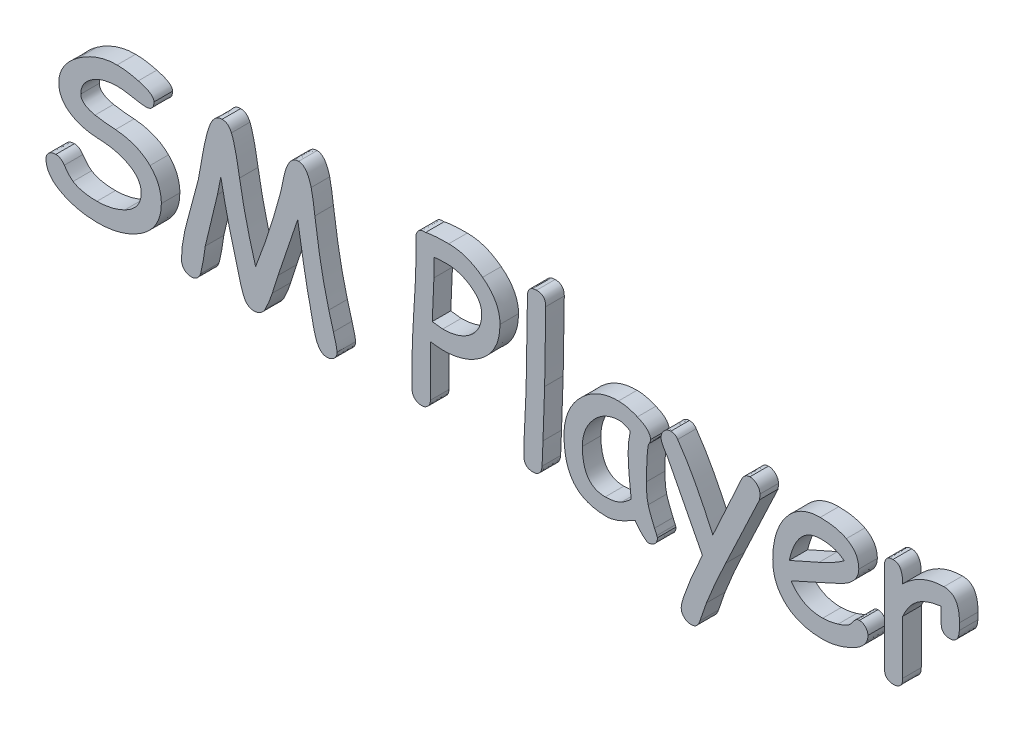
from build123d import *

# Parameters (mm, degrees)
BOSS_EXTRUDE1_DEPTH   = 1
BOSS_EXTRUDE1_2_DEPTH = 1
BOSS_EXTRUDE1_3_DEPTH = 1
BOSS_EXTRUDE1_4_DEPTH = 1
BOSS_EXTRUDE1_5_DEPTH = 1
BOSS_EXTRUDE1_6_DEPTH = 1
BOSS_EXTRUDE1_7_DEPTH = 1
BOSS_EXTRUDE1_8_DEPTH = 1


with BuildPart() as part:
    # Sketch1 → Boss-Extrude1 (new body)
    with BuildSketch(Plane.XY):
        with BuildLine():
            add(Edge.make_bspline(
                [(-23.681181073, 12.970587133), (-23.680205537, 13.005260343), (-23.678320451, 13.072261475), (-23.64907541, 13.167877608), (-23.600023652, 13.253308276), (-23.531739083, 13.326499313), (-23.449779316, 13.387193341), (-23.356809008, 13.430347792), (-23.254576781, 13.455812214), (-23.18396127, 13.459404232), (-23.147294087, 13.461269391)],
                knots=[0, 0, 0, 0, 1.020978776, 1.972898741, 2.919100688, 3.908607674, 4.908561358, 5.914730999, 6.917221763, 8, 8, 8, 8], degree=3))
            add(Edge.make_bspline(
                [(-23.147294087, 13.461269391), (-23.104984149, 13.458270384), (-23.019366104, 13.452201617), (-22.898968179, 13.392152026), (-22.786376137, 13.302018344), (-22.725866295, 13.221677569), (-22.693644452, 13.178895639)],
                knots=[0, 0, 0, 0, 0.907817167, 1.837051385, 2.848217297, 4, 4, 4, 4], degree=3))
            add(Edge.make_bspline(
                [(-22.693644452, 13.178895639), (-22.651124056, 13.119733054), (-22.571503048, 13.008948935), (-22.450418068, 12.862181594), (-22.33660403, 12.744458129), (-22.256674928, 12.6847827), (-22.219935479, 12.657352861)],
                knots=[0, 0, 0, 0, 1.23447497, 2.31159988, 3.223926103, 4, 4, 4, 4], degree=3))
            add(Edge.make_bspline(
                [(-22.219935479, 12.657352861), (-22.181299581, 12.634357784), (-22.102051527, 12.587191412), (-21.970856973, 12.531489934), (-21.829092636, 12.481074885), (-21.673652808, 12.443813624), (-21.506275422, 12.412923908), (-21.326586702, 12.389467511), (-21.133798093, 12.377955582), (-21.001471763, 12.375993574), (-20.93305182, 12.374979108)],
                knots=[0, 0, 0, 0, 0.807895578, 1.657115672, 2.558318706, 3.511992341, 4.528196508, 5.619539607, 6.769171901, 8, 8, 8, 8], degree=3))
            add(Edge.make_bspline(
                [(-20.93305182, 12.374979108), (-20.866167701, 12.376437837), (-20.733771705, 12.379325366), (-20.536775894, 12.394118241), (-20.343901972, 12.423069273), (-20.153397493, 12.459057157), (-19.96694014, 12.508696594), (-19.784597599, 12.569837479), (-19.604663969, 12.637715338), (-19.48940635, 12.693982459), (-19.43168755, 12.722159951)],
                knots=[0, 0, 0, 0, 1.032504842, 2.043826106, 3.046385216, 4.04124581, 5.034838662, 6.021429811, 7.009170089, 8, 8, 8, 8], degree=3))
            add(Edge.make_bspline(
                [(-19.43168755, 12.722159951), (-19.361389446, 12.759788967), (-19.226631456, 12.831921927), (-19.044945366, 12.959914133), (-18.891687407, 13.098892406), (-18.763347063, 13.24771901), (-18.667617247, 13.410535862), (-18.596372141, 13.582586149), (-18.553764501, 13.766275614), (-18.548604895, 13.892583476), (-18.545990643, 13.956580728)],
                knots=[0, 0, 0, 0, 1.189786699, 2.280762261, 3.308288894, 4.272931975, 5.202800241, 6.115543574, 7.045189811, 8, 8, 8, 8], degree=3))
            add(Edge.make_bspline(
                [(-18.545990643, 13.956580728), (-18.548524432, 14.009733076), (-18.553497665, 14.114058698), (-18.588153027, 14.26657888), (-18.647513231, 14.409766391), (-18.73103721, 14.544082488), (-18.836981253, 14.669858973), (-18.966730642, 14.785873857), (-19.119367978, 14.892960373), (-19.232459506, 14.954023485), (-19.291272187, 14.98577905)],
                knots=[0, 0, 0, 0, 0.949240243, 1.863136486, 2.777725302, 3.705920659, 4.677662452, 5.705515345, 6.80676479, 8, 8, 8, 8], degree=3))
            add(Edge.make_bspline(
                [(-19.291272187, 14.98577905), (-19.344871905, 15.012414134), (-19.453334528, 15.06631201), (-19.626091837, 15.13121212), (-19.806525912, 15.190430539), (-19.996579458, 15.239898559), (-20.196656843, 15.27824904), (-20.405891411, 15.306468831), (-20.623994258, 15.329575566), (-20.772516957, 15.334884307), (-20.848185391, 15.337588971)],
                knots=[0, 0, 0, 0, 0.891996852, 1.805015421, 2.748548653, 3.723361584, 4.731199176, 5.784448007, 6.871234155, 8, 8, 8, 8], degree=3))
            add(Edge.make_bspline(
                [(-20.848185391, 15.337588971), (-20.91561633, 15.340999472), (-21.048182288, 15.347704352), (-21.242867596, 15.369642965), (-21.429864535, 15.40032426), (-21.609276389, 15.440148361), (-21.780934855, 15.490405721), (-21.946221361, 15.54610004), (-22.102823619, 15.614367344), (-22.201762937, 15.667631123), (-22.250795999, 15.694027971)],
                knots=[0, 0, 0, 0, 1.109083175, 2.180403794, 3.216792943, 4.22137708, 5.197588291, 6.154329841, 7.085309469, 8, 8, 8, 8], degree=3))
            add(Edge.make_bspline(
                [(-22.250795999, 15.694027971), (-22.309307595, 15.729207612), (-22.423360598, 15.797781091), (-22.574781792, 15.920151388), (-22.703852378, 16.053883261), (-22.806991412, 16.20041482), (-22.891578696, 16.355915771), (-22.94718367, 16.52485498), (-22.985094918, 16.70404865), (-22.988275822, 16.827943357), (-22.989905438, 16.891416124)],
                knots=[0, 0, 0, 0, 1.104423339, 2.152783505, 3.142433753, 4.103820206, 5.046408413, 5.997202751, 6.973942584, 8, 8, 8, 8], degree=3))
            add(Edge.make_bspline(
                [(-22.989905438, 16.891416124), (-22.986491654, 16.96727993), (-22.979639118, 17.119562359), (-22.928472261, 17.34423321), (-22.845071472, 17.563644601), (-22.728536177, 17.777705168), (-22.575730532, 17.984469353), (-22.395388183, 18.189483647), (-22.178033651, 18.38604138), (-22.016764355, 18.507231042), (-21.932932649, 18.57022838)],
                knots=[0, 0, 0, 0, 0.882315765, 1.771084206, 2.667078851, 3.607169967, 4.597299244, 5.653059042, 6.780002939, 8, 8, 8, 8], degree=3))
            add(Edge.make_bspline(
                [(-21.932932649, 18.57022838), (-21.849418924, 18.627613784), (-21.685000508, 18.74059183), (-21.427645067, 18.884815517), (-21.169630629, 19.009033476), (-20.909579576, 19.11191242), (-20.646815502, 19.190931013), (-20.381912219, 19.245985275), (-20.115212255, 19.281999771), (-19.936371951, 19.285820851), (-19.846761537, 19.287735456)],
                knots=[0, 0, 0, 0, 1.084105602, 2.134342923, 3.153783451, 4.147494286, 5.124611481, 6.086661538, 7.041295226, 8, 8, 8, 8], degree=3))
            add(Edge.make_bspline(
                [(-19.846761537, 19.287735456), (-19.759248209, 19.28537373), (-19.57858242, 19.280498093), (-19.299533087, 19.248334646), (-19.005010308, 19.193831695), (-18.804968985, 19.143797884), (-18.701836266, 19.118002599)],
                knots=[0, 0, 0, 0, 0.904920533, 1.868151822, 2.900910592, 4, 4, 4, 4], degree=3))
            add(Edge.make_bspline(
                [(-18.701836266, 19.118002599), (-18.635239235, 19.099785081), (-18.510257721, 19.065596576), (-18.337415769, 19.005173193), (-18.190378552, 18.941956314), (-18.070145556, 18.872508015), (-17.975596095, 18.800213197), (-17.905843605, 18.72426941), (-17.863952335, 18.640839718), (-17.857739739, 18.582972138), (-17.854715009, 18.55479812)],
                knots=[0, 0, 0, 0, 1.536451653, 2.883432639, 4.072626447, 5.093694848, 5.966289869, 6.712663879, 7.373234022, 8, 8, 8, 8], degree=3))
            add(Edge.make_bspline(
                [(-17.854715009, 18.55479812), (-17.856050374, 18.519160805), (-17.858556209, 18.452286768), (-17.880831223, 18.358825928), (-17.915278836, 18.278120117), (-17.96836828, 18.212347233), (-18.036711887, 18.162415701), (-18.118744667, 18.126394246), (-18.215440945, 18.10723651), (-18.284110204, 18.104271677), (-18.320708852, 18.10269151)],
                knots=[0, 0, 0, 0, 1.147274365, 2.152880138, 3.080677453, 3.953489691, 4.842381196, 5.785320622, 6.819642577, 8, 8, 8, 8], degree=3))
            add(Edge.make_bspline(
                [(-18.320708852, 18.10269151), (-18.361910691, 18.104100458), (-18.457534855, 18.107370443), (-18.619815714, 18.130918604), (-18.821376038, 18.16003699), (-19.048916809, 18.205088641), (-19.281221955, 18.249484096), (-19.496417393, 18.280094835), (-19.682835221, 18.299449505), (-19.797347392, 18.299963283), (-19.849847588, 18.300198835)],
                knots=[0, 0, 0, 0, 0.64035602, 1.486183851, 2.545593541, 3.806237026, 5.090462414, 6.221050272, 7.184407993, 8, 8, 8, 8], degree=3))
            add(Edge.make_bspline(
                [(-19.849847588, 18.300198835), (-19.916248459, 18.297923304), (-20.046757025, 18.293450829), (-20.237938561, 18.27304701), (-20.421609454, 18.24252205), (-20.597555834, 18.199393082), (-20.766405366, 18.143959207), (-20.926954612, 18.075474946), (-21.080658981, 17.997352858), (-21.176807056, 17.935822874), (-21.224683728, 17.905184186)],
                knots=[0, 0, 0, 0, 1.098563762, 2.159188293, 3.177307101, 4.17590561, 5.152410848, 6.113039325, 7.060393052, 8, 8, 8, 8], degree=3))
            add(Edge.make_bspline(
                [(-21.224683728, 17.905184186), (-21.270692258, 17.872709589), (-21.359869382, 17.809764929), (-21.477861497, 17.702038021), (-21.578104542, 17.589784386), (-21.662357345, 17.472796224), (-21.725265355, 17.349127587), (-21.770629458, 17.220472711), (-21.799821288, 17.0866288), (-21.803166793, 16.994949278), (-21.804861493, 16.948508085)],
                knots=[0, 0, 0, 0, 1.156832391, 2.242257832, 3.2758141, 4.246901468, 5.197449485, 6.117149032, 7.046222712, 8, 8, 8, 8], degree=3))
            add(Edge.make_bspline(
                [(-21.804861493, 16.948508085), (-21.802379397, 16.914267884), (-21.797428436, 16.845970015), (-21.760414099, 16.74783432), (-21.697536222, 16.659261971), (-21.610383938, 16.580462558), (-21.50061435, 16.509705513), (-21.368017248, 16.446293601), (-21.210592517, 16.393340333), (-21.096840267, 16.364910869), (-21.03643456, 16.349814008)],
                knots=[0, 0, 0, 0, 0.779947725, 1.555737587, 2.356322645, 3.236265005, 4.218915667, 5.326038242, 6.580049603, 8, 8, 8, 8], degree=3))
            add(Edge.make_bspline(
                [(-21.03643456, 16.349814008), (-21.009742969, 16.343872258), (-20.951513411, 16.330909919), (-20.854512223, 16.316265799), (-20.741329565, 16.301007313), (-20.61117615, 16.285619845), (-20.464571389, 16.270258956), (-20.301492189, 16.255123312), (-20.121552729, 16.239069241), (-19.995940926, 16.230739213), (-19.930084939, 16.22637193)],
                knots=[0, 0, 0, 0, 0.588960752, 1.284858742, 2.112302552, 3.049675239, 4.108181828, 5.287978176, 6.578136203, 8, 8, 8, 8], degree=3))
            add(Edge.make_bspline(
                [(-19.930084939, 16.22637193), (-19.833711914, 16.217576118), (-19.645166388, 16.200367868), (-19.371964573, 16.150039295), (-19.114213211, 16.084304819), (-18.872732322, 15.999803624), (-18.647960749, 15.895547423), (-18.438476548, 15.775460433), (-18.245508543, 15.636203247), (-18.129908789, 15.529602415), (-18.072281671, 15.476461309)],
                knots=[0, 0, 0, 0, 1.134643475, 2.219832288, 3.254399288, 4.252361306, 5.2160512, 6.156708817, 7.081109121, 8, 8, 8, 8], degree=3))
            add(Edge.make_bspline(
                [(-18.072281671, 15.476461309), (-18.023383243, 15.425968633), (-17.926716435, 15.326150171), (-17.801939173, 15.161839765), (-17.695979809, 14.989191025), (-17.609104095, 14.808372782), (-17.54272174, 14.618774884), (-17.494887811, 14.421380343), (-17.464433141, 14.215728591), (-17.461292477, 14.075501005), (-17.45970036, 14.004414533)],
                knots=[0, 0, 0, 0, 1.028307477, 2.03285068, 3.013053631, 3.989779647, 4.963831607, 5.94821947, 6.959877708, 8, 8, 8, 8], degree=3))
            add(Edge.make_bspline(
                [(-17.45970036, 14.004414533), (-17.463247407, 13.903866947), (-17.470230671, 13.705913496), (-17.525715924, 13.417393498), (-17.615196247, 13.143904582), (-17.743556988, 12.887337873), (-17.907222871, 12.64628989), (-18.107076919, 12.421144332), (-18.342905443, 12.211413525), (-18.520861137, 12.090139962), (-18.61234076, 12.027798265)],
                knots=[0, 0, 0, 0, 1.006906322, 1.982350743, 2.932524148, 3.882138281, 4.847028019, 5.843859457, 6.891617794, 8, 8, 8, 8], degree=3))
            add(Edge.make_bspline(
                [(-18.61234076, 12.027798265), (-18.696493711, 11.97664462), (-18.865000373, 11.874215296), (-19.131067238, 11.743136416), (-19.407951369, 11.633655531), (-19.694444759, 11.544617793), (-19.989942304, 11.472183185), (-20.296142006, 11.424714251), (-20.611890687, 11.391628666), (-20.825979283, 11.388851469), (-20.934594846, 11.387442487)],
                knots=[0, 0, 0, 0, 0.96740237, 1.93711262, 2.910412234, 3.890342931, 4.88332579, 5.897071892, 6.933101885, 8, 8, 8, 8], degree=3))
            add(Edge.make_bspline(
                [(-20.934594846, 11.387442487), (-21.013837655, 11.38868693), (-21.170446189, 11.391146338), (-21.403149475, 11.409000059), (-21.63051349, 11.43555821), (-21.85277534, 11.476796456), (-22.069730586, 11.527154139), (-22.282136085, 11.588971378), (-22.489195188, 11.662922021), (-22.623478277, 11.721027452), (-22.6905584, 11.75005359)],
                knots=[0, 0, 0, 0, 1.052595361, 2.080257086, 3.098952793, 4.092052013, 5.081501202, 6.056668516, 7.029223139, 8, 8, 8, 8], degree=3))
            add(Edge.make_bspline(
                [(-22.6905584, 11.75005359), (-22.767525229, 11.787075264), (-22.915399411, 11.858203955), (-23.115412626, 11.985751644), (-23.287499674, 12.121860075), (-23.426031314, 12.27251215), (-23.538676638, 12.430442137), (-23.617723517, 12.601608132), (-23.669615999, 12.782455626), (-23.677302256, 12.907489591), (-23.681181073, 12.970587133)],
                knots=[0, 0, 0, 0, 1.230486047, 2.364097874, 3.413457518, 4.384300228, 5.305970186, 6.198444544, 7.090857273, 8, 8, 8, 8], degree=3))
        make_face()
    extrude(amount=BOSS_EXTRUDE1_DEPTH)


with BuildPart() as body_2:
    # Sketch1 → Boss-Extrude1 2 (new body)
    with BuildSketch(Plane.XY):
        with BuildLine():
            add(Edge.make_bspline(
                [(-8.522493939, 11.288688825), (-8.567342492, 11.291592378), (-8.655731812, 11.297314815), (-8.779862127, 11.355109249), (-8.890512094, 11.445485995), (-8.94761508, 11.52572247), (-8.977686601, 11.567976526)],
                knots=[0, 0, 0, 0, 0.959160072, 1.890351017, 2.889018652, 4, 4, 4, 4], degree=3))
            add(Edge.make_bspline(
                [(-8.977686601, 11.567976526), (-9.00352067, 11.61372269), (-9.061195973, 11.715852321), (-9.128209654, 11.898114654), (-9.197029892, 12.117663235), (-9.234005307, 12.278977023), (-9.253888249, 12.365720952)],
                knots=[0, 0, 0, 0, 0.742751013, 1.658213032, 2.74074123, 4, 4, 4, 4], degree=3))
            Line((-9.253888249, 12.365720952), (-9.43750834, 13.260676015))
            add(Edge.make_bspline(
                [(-9.43750834, 13.260676015), (-9.447038506, 13.298159995), (-9.467209952, 13.377498185), (-9.493620315, 13.505722269), (-9.527615264, 13.648025341), (-9.558590244, 13.8080009), (-9.59502818, 13.982484438), (-9.629720671, 14.173664222), (-9.668207644, 14.379927237), (-9.710800061, 14.601768495), (-9.751258776, 14.839797408), (-9.796700374, 15.092639723), (-9.843026371, 15.361639617), (-9.890214763, 15.646780618), (-9.941690259, 15.947491007), (-9.993947386, 16.263847525), (-10.048025025, 16.595587688), (-10.084105995, 16.821968711), (-10.102552533, 16.937706903)],
                knots=[0, 0, 0, 0, 0.496658207, 1.051221438, 1.68101768, 2.375400972, 3.143623008, 3.970205625, 4.870641242, 5.838436678, 6.871229342, 7.971369117, 9.137717576, 10.376808206, 11.683232474, 13.055897193, 14.494815811, 16, 16, 16, 16], degree=3))
            Line((-10.102552533, 16.937706903), (-11.161068349, 13.797649053))
            Line((-11.161068349, 13.797649053), (-11.474302621, 12.808569406))
            add(Edge.make_bspline(
                [(-11.474302621, 12.808569406), (-11.505250357, 12.714618884), (-11.564534234, 12.534646069), (-11.664749312, 12.28107779), (-11.762768272, 12.052354071), (-11.836089671, 11.912190063), (-11.870860295, 11.8457212)],
                knots=[0, 0, 0, 0, 1.138108356, 2.180174859, 3.13699879, 4, 4, 4, 4], degree=3))
            add(Edge.make_bspline(
                [(-11.870860295, 11.8457212), (-11.889103069, 11.816847998), (-11.924510521, 11.760807917), (-11.989048951, 11.688806317), (-12.055610971, 11.625352472), (-12.128284024, 11.574170689), (-12.206541344, 11.535298911), (-12.289058429, 11.507400251), (-12.376246716, 11.489902452), (-12.436040218, 11.487446135), (-12.46646832, 11.486196149)],
                knots=[0, 0, 0, 0, 1.12138879, 2.176506675, 3.170017907, 4.141537379, 5.087232601, 6.03413754, 6.999599269, 8, 8, 8, 8], degree=3))
            add(Edge.make_bspline(
                [(-12.46646832, 11.486196149), (-12.515928186, 11.489521207), (-12.613068161, 11.496051673), (-12.749001752, 11.555526181), (-12.867670773, 11.651439411), (-12.925360817, 11.737392277), (-12.955607552, 11.782457135)],
                knots=[0, 0, 0, 0, 0.986319395, 1.937147192, 2.918451782, 4, 4, 4, 4], degree=3))
            add(Edge.make_bspline(
                [(-12.955607552, 11.782457135), (-12.975318315, 11.821244047), (-13.016376736, 11.902038958), (-13.067037365, 12.035339797), (-13.121123354, 12.180967846), (-13.150284102, 12.285231616), (-13.165459084, 12.339489511)],
                knots=[0, 0, 0, 0, 0.874902059, 1.822461019, 2.866828981, 4, 4, 4, 4], degree=3))
            Line((-13.165459084, 12.339489511), (-13.31667563, 12.91812425))
            add(Edge.make_bspline(
                [(-13.31667563, 12.91812425), (-13.403460405, 13.229439987), (-13.579520651, 13.861006129), (-13.821079887, 14.829224169), (-14.046505047, 15.829990378), (-14.181721929, 16.509982345), (-14.250206342, 16.8543835)],
                knots=[0, 0, 0, 0, 0.958328754, 1.944161251, 2.958762347, 4, 4, 4, 4], degree=3))
            Line((-14.250206342, 16.8543835), (-14.433826432, 15.930110944))
            Line((-14.433826432, 15.930110944), (-15.08961247, 13.202041028))
            add(Edge.make_bspline(
                [(-15.08961247, 13.202041028), (-15.093417121, 13.159830298), (-15.101506223, 13.070085707), (-15.120966788, 12.928772569), (-15.143596224, 12.772749871), (-15.173389795, 12.60253491), (-15.20910513, 12.418013529), (-15.249303708, 12.218973289), (-15.293834071, 12.005352433), (-15.32701778, 11.858531615), (-15.344211755, 11.782457135)],
                knots=[0, 0, 0, 0, 0.704684958, 1.498236636, 2.371575818, 3.326349705, 4.371405418, 5.496944069, 6.703053969, 8, 8, 8, 8], degree=3))
            add(Edge.make_bspline(
                [(-15.344211755, 11.782457135), (-15.357327931, 11.751212664), (-15.382512528, 11.691219613), (-15.4310641, 11.610936683), (-15.483335641, 11.540977521), (-15.544301905, 11.485032142), (-15.611462056, 11.440926584), (-15.685158834, 11.409843587), (-15.765004976, 11.390719199), (-15.82038334, 11.388553204), (-15.848781247, 11.387442487)],
                knots=[0, 0, 0, 0, 1.182980922, 2.271462135, 3.271240398, 4.225523803, 5.148115151, 6.066492127, 7.00850128, 8, 8, 8, 8], degree=3))
            add(Edge.make_bspline(
                [(-15.848781247, 11.387442487), (-15.888701934, 11.389121558), (-15.965524246, 11.392352717), (-16.073306899, 11.428486776), (-16.169830621, 11.484385601), (-16.219835205, 11.538720966), (-16.245338921, 11.5664335)],
                knots=[0, 0, 0, 0, 1.060616523, 2.041022336, 3.000867405, 4, 4, 4, 4], degree=3))
            add(Edge.make_bspline(
                [(-16.245338921, 11.5664335), (-16.265016184, 11.59248786), (-16.304753158, 11.645102976), (-16.343475101, 11.737723079), (-16.369923711, 11.83807234), (-16.37222425, 11.908283887), (-16.373410077, 11.944474862)],
                knots=[0, 0, 0, 0, 0.958743918, 1.936122096, 2.936161401, 4, 4, 4, 4], degree=3))
            add(Edge.make_bspline(
                [(-16.373410077, 11.944474862), (-16.37188305, 12.017529161), (-16.368740026, 12.167894126), (-16.353515065, 12.399180027), (-16.324633081, 12.642487482), (-16.286360523, 12.897794759), (-16.236131583, 13.1657375), (-16.176728363, 13.445954667), (-16.103105104, 13.737697897), (-16.049185334, 13.935581484), (-16.021600156, 14.036818078)],
                knots=[0, 0, 0, 0, 0.824042072, 1.69609536, 2.612788883, 3.586582681, 4.607146524, 5.686861406, 6.816605879, 8, 8, 8, 8], degree=3))
            Line((-16.021600156, 14.036818078), (-15.461481728, 16.136876424))
            Line((-15.461481728, 16.136876424), (-15.166763768, 17.777113031))
            add(Edge.make_bspline(
                [(-15.166763768, 17.777113031), (-15.148206792, 17.868767672), (-15.11256613, 18.044800236), (-15.054020058, 18.295276347), (-14.995487904, 18.521188502), (-14.937395879, 18.7222065), (-14.878345083, 18.898328742), (-14.81566456, 19.048650094), (-14.756447838, 19.176016564), (-14.709713143, 19.248532636), (-14.688425717, 19.281563352)],
                knots=[0, 0, 0, 0, 1.414207589, 2.716137283, 3.889666348, 4.943215356, 5.880445309, 6.696617245, 7.406315533, 8, 8, 8, 8], degree=3))
            add(Edge.make_bspline(
                [(-14.688425717, 19.281563352), (-14.653929983, 19.327723121), (-14.588561104, 19.415195161), (-14.462791957, 19.511472126), (-14.325647297, 19.574268337), (-14.228230589, 19.58074067), (-14.179227147, 19.583996442)],
                knots=[0, 0, 0, 0, 1.116006581, 2.11481503, 3.051697038, 4, 4, 4, 4], degree=3))
            add(Edge.make_bspline(
                [(-14.179227147, 19.583996442), (-14.151849728, 19.582908819), (-14.098487044, 19.580788878), (-14.021931085, 19.561405328), (-13.950734882, 19.531236353), (-13.883416938, 19.490323043), (-13.825244265, 19.432069942), (-13.769298183, 19.366312775), (-13.718819538, 19.287715581), (-13.692876612, 19.22899828), (-13.679286733, 19.19823995)],
                knots=[0, 0, 0, 0, 0.974538665, 1.899521645, 2.795144295, 3.726104902, 4.685870392, 5.714123837, 6.802572119, 8, 8, 8, 8], degree=3))
            add(Edge.make_bspline(
                [(-13.679286733, 19.19823995), (-13.661222843, 19.154737373), (-13.621569249, 19.059241133), (-13.570206069, 18.897514378), (-13.519081944, 18.705975846), (-13.462632806, 18.485213422), (-13.407750072, 18.233445323), (-13.352936849, 17.951302045), (-13.295729509, 17.639607587), (-13.258800442, 17.42174981), (-13.239524331, 17.308033136)],
                knots=[0, 0, 0, 0, 0.581236301, 1.275921689, 2.09225498, 3.028489211, 4.088314635, 5.272448532, 6.576281799, 8, 8, 8, 8], degree=3))
            add(Edge.make_bspline(
                [(-13.239524331, 17.308033136), (-13.215515013, 17.163895012), (-13.166891595, 16.871987994), (-13.080389075, 16.431117103), (-12.988813342, 15.980092542), (-12.885465189, 15.520674189), (-12.770056906, 15.053126098), (-12.64907275, 14.575790824), (-12.516198596, 14.090366817), (-12.42163156, 13.764609414), (-12.373886762, 13.600141729)],
                knots=[0, 0, 0, 0, 0.920409794, 1.864004282, 2.829825251, 3.819421933, 4.829969225, 5.863304241, 6.92122972, 8, 8, 8, 8], degree=3))
            add(Edge.make_bspline(
                [(-12.373886762, 13.600141729), (-12.245895836, 13.936830268), (-11.988488953, 14.613955988), (-11.636433714, 15.648418913), (-11.309642997, 16.703651166), (-11.115271782, 17.418020173), (-11.017566934, 17.777113031)],
                knots=[0, 0, 0, 0, 0.983642058, 1.97823584, 2.98371701, 4, 4, 4, 4], degree=3))
            Line((-11.017566934, 17.777113031), (-10.858635259, 18.537824834))
            add(Edge.make_bspline(
                [(-10.858635259, 18.537824834), (-10.842666795, 18.610612811), (-10.812080367, 18.75003287), (-10.752333939, 18.945851739), (-10.69037885, 19.121990022), (-10.636030174, 19.227028489), (-10.610208077, 19.276934274)],
                knots=[0, 0, 0, 0, 1.142374087, 2.188134223, 3.139147904, 4, 4, 4, 4], degree=3))
            add(Edge.make_bspline(
                [(-10.610208077, 19.276934274), (-10.593587132, 19.309352496), (-10.561637024, 19.371669388), (-10.501671447, 19.453127348), (-10.440190105, 19.524646066), (-10.371808277, 19.5813643), (-10.299752155, 19.627795816), (-10.222515319, 19.66011226), (-10.140018337, 19.679463727), (-10.083628418, 19.681636287), (-10.054718728, 19.682750104)],
                knots=[0, 0, 0, 0, 1.199142974, 2.305088297, 3.326121748, 4.301047848, 5.223219202, 6.142892288, 7.047907664, 8, 8, 8, 8], degree=3))
            add(Edge.make_bspline(
                [(-10.054718728, 19.682750104), (-10.018319798, 19.680078366), (-9.945143909, 19.674707141), (-9.840221641, 19.630054501), (-9.745041178, 19.557125254), (-9.653778967, 19.46040117), (-9.575383912, 19.331735797), (-9.499791969, 19.179206034), (-9.432063289, 18.998016658), (-9.395319898, 18.866804763), (-9.375787301, 18.797053197)],
                knots=[0, 0, 0, 0, 0.729308629, 1.466191666, 2.249505672, 3.126830601, 4.121493211, 5.262973959, 6.545011104, 8, 8, 8, 8], degree=3))
            add(Edge.make_bspline(
                [(-9.375787301, 18.797053197), (-9.36827336, 18.769352371), (-9.35140813, 18.707177167), (-9.331389132, 18.602748294), (-9.30789128, 18.478869005), (-9.283045533, 18.335444951), (-9.258989076, 18.171693331), (-9.232805086, 17.988579711), (-9.204813101, 17.785439552), (-9.186404356, 17.643398037), (-9.176736951, 17.568804525)],
                knots=[0, 0, 0, 0, 0.553116127, 1.241483132, 2.04851274, 2.984162884, 4.047067603, 5.238941889, 6.55002235, 8, 8, 8, 8], degree=3))
            add(Edge.make_bspline(
                [(-9.176736951, 17.568804525), (-9.150880041, 17.375875878), (-9.100161796, 16.997446964), (-9.019046967, 16.440609795), (-8.930307493, 15.906451564), (-8.840427073, 15.392674534), (-8.742221562, 14.901287083), (-8.643240945, 14.430081401), (-8.536430233, 13.981258737), (-8.460738018, 13.690029388), (-8.423740277, 13.547678846)],
                knots=[0, 0, 0, 0, 1.141110976, 2.238285472, 3.29858376, 4.315316321, 5.295745137, 6.236035004, 7.137788224, 8, 8, 8, 8], degree=3))
            Line((-8.423740277, 13.547678846), (-8.17377007, 12.652723783))
            add(Edge.make_bspline(
                [(-8.17377007, 12.652723783), (-8.158061769, 12.597764725), (-8.128330726, 12.493743921), (-8.090300836, 12.344666521), (-8.056235438, 12.212649054), (-8.02758334, 12.097202367), (-8.008252555, 11.998036634), (-7.99229343, 11.9164621), (-7.981894794, 11.851122887), (-7.980114916, 11.81282782), (-7.979348798, 11.796344369)],
                knots=[0, 0, 0, 0, 1.559778982, 2.952187862, 4.198165584, 5.280768401, 6.197425036, 6.954465388, 7.549967658, 8, 8, 8, 8], degree=3))
            add(Edge.make_bspline(
                [(-7.979348798, 11.796344369), (-7.981476522, 11.761658502), (-7.985661892, 11.693429163), (-8.017462985, 11.595369486), (-8.071592853, 11.507378499), (-8.144213262, 11.431078011), (-8.229228041, 11.368799035), (-8.322232198, 11.323173312), (-8.420437759, 11.293848242), (-8.488346194, 11.290415153), (-8.522493939, 11.288688825)],
                knots=[0, 0, 0, 0, 1.009991958, 1.986719327, 2.968954602, 3.997799753, 5.038376203, 6.024038288, 7.006387982, 8, 8, 8, 8], degree=3))
        make_face()
    extrude(amount=BOSS_EXTRUDE1_2_DEPTH)


with BuildPart() as body_3:
    # Sketch1 → Boss-Extrude1 3 (new body)
    with BuildSketch(Plane.XY):
        with BuildLine():
            add(Edge.make_bspline(
                [(-2.301013226, 14.745066999), (-2.332917294, 14.746372536), (-2.411261986, 14.749578455), (-2.550203215, 14.762929127), (-2.732162837, 14.785151721), (-2.867834359, 14.80305362), (-2.94291203, 14.812960141)],
                knots=[0, 0, 0, 0, 0.593305599, 1.456941008, 2.592726431, 4, 4, 4, 4], degree=3))
            add(Edge.make_bspline(
                [(-2.94291203, 14.812960141), (-2.94291203, 14.741466605), (-2.94291203, 14.586649666), (-2.94291203, 14.336165117), (-2.94291203, 14.049162286), (-2.94291203, 13.725126832), (-2.94291203, 13.364573097), (-2.94291203, 12.967501081), (-2.94291203, 12.533910783), (-2.94291203, 12.232506377), (-2.94291203, 12.07563207)],
                knots=[0, 0, 0, 0, 0.626832018, 1.357384442, 2.196166855, 3.143179256, 4.198421646, 5.357384442, 6.624577227, 8, 8, 8, 8], degree=3))
            add(Edge.make_bspline(
                [(-2.94291203, 12.07563207), (-2.944692409, 12.042522803), (-2.948173392, 11.977787842), (-2.975560115, 11.884979214), (-3.019377825, 11.799571082), (-3.080979218, 11.72510405), (-3.155039168, 11.662864684), (-3.239859771, 11.616960534), (-3.334303249, 11.590363416), (-3.399997257, 11.586781609), (-3.433594289, 11.584949811)],
                knots=[0, 0, 0, 0, 1.026075602, 2.006174453, 2.977131608, 3.986810973, 4.98417594, 5.962583505, 6.958030584, 8, 8, 8, 8], degree=3))
            add(Edge.make_bspline(
                [(-3.433594289, 11.584949811), (-3.468207839, 11.586768456), (-3.535405737, 11.590299129), (-3.631607463, 11.6165433), (-3.716900443, 11.663364727), (-3.792286977, 11.724554191), (-3.854430544, 11.799891092), (-3.897430536, 11.886189633), (-3.925402338, 11.979797965), (-3.928732581, 12.045078921), (-3.930448651, 12.078718122)],
                knots=[0, 0, 0, 0, 1.061874494, 2.061497135, 3.029071816, 4.027572055, 5.026072295, 6.000319983, 6.969567223, 8, 8, 8, 8], degree=3))
            Line((-3.930448651, 12.078718122), (-3.930448651, 13.607856859))
            add(Edge.make_bspline(
                [(-3.930448651, 13.607856859), (-3.9301585, 13.674724696), (-3.929549123, 13.815161163), (-3.92392926, 14.035792768), (-3.919017239, 14.276069473), (-3.906707417, 14.535728845), (-3.895357889, 14.814570875), (-3.878894174, 15.112815194), (-3.863100893, 15.430806917), (-3.848486238, 15.649299553), (-3.840953145, 15.761921113)],
                knots=[0, 0, 0, 0, 0.744256809, 1.563095212, 2.456470496, 3.419085357, 4.45630082, 5.562685376, 6.743691415, 8, 8, 8, 8], degree=3))
            add(Edge.make_bspline(
                [(-3.840953145, 15.761921113), (-3.833103492, 15.882783113), (-3.818007187, 16.115222625), (-3.798354961, 16.451145591), (-3.779604205, 16.760219113), (-3.763477654, 17.042541927), (-3.753300377, 17.298254343), (-3.744334782, 17.527141431), (-3.735258838, 17.729729532), (-3.733677096, 17.855799307), (-3.732941327, 17.914442342)],
                knots=[0, 0, 0, 0, 1.348595074, 2.593592527, 3.746778752, 4.796392066, 5.74220492, 6.596226593, 7.347016105, 8, 8, 8, 8], degree=3))
            Line((-3.732941327, 17.914442342), (-3.732941327, 18.631949418))
            add(Edge.make_bspline(
                [(-3.732941327, 18.631949418), (-3.732941327, 18.712186769), (-3.732941327, 18.860317262), (-3.732941327, 19.065025374), (-3.732941327, 19.234243889), (-3.732941327, 19.335569261), (-3.732941327, 19.380317014)],
                knots=[0, 0, 0, 0, 1.286597938, 2.375257732, 3.282474227, 4, 4, 4, 4], degree=3))
            add(Edge.make_bspline(
                [(-3.732941327, 19.380317014), (-3.72203166, 19.416133334), (-3.701461418, 19.483665223), (-3.65804417, 19.575184009), (-3.605163825, 19.650193691), (-3.544550812, 19.710987142), (-3.473043262, 19.754024194), (-3.392546775, 19.778091358), (-3.303956892, 19.788178529), (-3.243255287, 19.780765245), (-3.211398549, 19.776874688)],
                knots=[0, 0, 0, 0, 1.225321951, 2.310351965, 3.301321782, 4.218671067, 5.102777083, 6.003264188, 6.95209541, 8, 8, 8, 8], degree=3))
            add(Edge.make_bspline(
                [(-3.211398549, 19.776874688), (-3.180153144, 19.78568379), (-3.112170144, 19.80485042), (-2.999170478, 19.822547266), (-2.869311813, 19.842372274), (-2.72085746, 19.855107187), (-2.554651506, 19.865346061), (-2.370556796, 19.875472674), (-2.168329266, 19.879295396), (-2.027383375, 19.879927548), (-1.953832383, 19.880257428)],
                knots=[0, 0, 0, 0, 0.615327298, 1.338814336, 2.166746272, 3.107551674, 4.163548125, 5.32613838, 6.604676068, 8, 8, 8, 8], degree=3))
            add(Edge.make_bspline(
                [(-1.953832383, 19.880257428), (-1.873002233, 19.877930338), (-1.712364589, 19.8733056), (-1.47361964, 19.843838932), (-1.23870339, 19.792373482), (-1.008318621, 19.719564974), (-0.780461396, 19.627863036), (-0.557360877, 19.514785643), (-0.337112689, 19.382330825), (-0.19760485, 19.279620396), (-0.126889634, 19.227557443)],
                knots=[0, 0, 0, 0, 0.981801419, 1.951181182, 2.916789142, 3.898809174, 4.882576362, 5.896758677, 6.9338867, 8, 8, 8, 8], degree=3))
            add(Edge.make_bspline(
                [(-0.126889634, 19.227557443), (-0.052574738, 19.167795827), (0.092650488, 19.051010435), (0.283556579, 18.856067686), (0.446961409, 18.652696163), (0.577857146, 18.438363044), (0.683819668, 18.216747997), (0.755527593, 17.983753122), (0.802763721, 17.742513095), (0.807393554, 17.577773177), (0.80972713, 17.494739278)],
                knots=[0, 0, 0, 0, 1.11821384, 2.185199293, 3.19473146, 4.172962323, 5.126088507, 6.069070675, 7.026753238, 8, 8, 8, 8], degree=3))
            add(Edge.make_bspline(
                [(0.80972713, 17.494739278), (0.806889677, 17.389635961), (0.801325064, 17.183514727), (0.753917236, 16.882789832), (0.677181859, 16.598310295), (0.568060921, 16.330560268), (0.428625513, 16.078958485), (0.257163015, 15.844696767), (0.055396657, 15.626276217), (-0.099089974, 15.498411007), (-0.177809491, 15.433256582)],
                knots=[0, 0, 0, 0, 1.062640722, 2.083976256, 3.070982761, 4.037131393, 5.00131682, 5.973289506, 6.967278458, 8, 8, 8, 8], degree=3))
            add(Edge.make_bspline(
                [(-0.177809491, 15.433256582), (-0.252380064, 15.377697179), (-0.400580689, 15.267279115), (-0.640858703, 15.12953088), (-0.889113806, 15.009082935), (-1.150628249, 14.913944343), (-1.42236848, 14.837854357), (-1.705773638, 14.784365837), (-1.999836559, 14.751016073), (-2.199597658, 14.747070237), (-2.301013226, 14.745066999)],
                knots=[0, 0, 0, 0, 0.980553228, 1.94873925, 2.917442457, 3.889455195, 4.881108055, 5.892427479, 6.930018568, 8, 8, 8, 8], degree=3))
        make_face()
        with BuildLine():
            add(Edge.make_bspline(
                [(-2.03561276, 18.892720807), (-2.107632683, 18.892109101), (-2.243487005, 18.890955212), (-2.433839868, 18.883094204), (-2.598827621, 18.872448723), (-2.699177053, 18.857804988), (-2.745404706, 18.851059106)],
                knots=[0, 0, 0, 0, 1.214313471, 2.290612446, 3.212541895, 4, 4, 4, 4], degree=3))
            Line((-2.745404706, 18.851059106), (-2.754662862, 17.886667875))
            Line((-2.754662862, 17.886667875), (-2.844158368, 15.800496763))
            Line((-2.844158368, 15.800496763), (-2.279410863, 15.73260362))
            add(Edge.make_bspline(
                [(-2.279410863, 15.73260362), (-2.208913051, 15.734351383), (-2.070207134, 15.737790143), (-1.866200837, 15.756974438), (-1.671144126, 15.793766757), (-1.484074149, 15.839837467), (-1.306502685, 15.904694457), (-1.137441842, 15.981705618), (-0.9748598, 16.070346381), (-0.875568161, 16.142453904), (-0.825880399, 16.178538125)],
                knots=[0, 0, 0, 0, 1.093384035, 2.151255904, 3.172786161, 4.169001568, 5.135234342, 6.098929207, 7.04866156, 8, 8, 8, 8], degree=3))
            add(Edge.make_bspline(
                [(-0.825880399, 16.178538125), (-0.774454964, 16.219565858), (-0.672931426, 16.300562366), (-0.540711828, 16.439901435), (-0.428013467, 16.589360124), (-0.336259238, 16.749559444), (-0.264939848, 16.920647738), (-0.213792765, 17.101879356), (-0.184395989, 17.294219459), (-0.180043176, 17.425717074), (-0.177809491, 17.493196252)],
                knots=[0, 0, 0, 0, 1.035286189, 2.043850807, 3.016094581, 3.977816293, 4.94382854, 5.928750352, 6.937119695, 8, 8, 8, 8], degree=3))
            add(Edge.make_bspline(
                [(-0.177809491, 17.493196252), (-0.179417771, 17.541697755), (-0.182596636, 17.637564009), (-0.213302219, 17.778470734), (-0.2633666, 17.913618239), (-0.331725503, 18.043832267), (-0.419357279, 18.169261251), (-0.528785911, 18.287186166), (-0.655126396, 18.40233471), (-0.750532244, 18.470386801), (-0.799648957, 18.505421289)],
                knots=[0, 0, 0, 0, 0.938313576, 1.854635507, 2.77807754, 3.722715476, 4.695508292, 5.732156521, 6.832471813, 8, 8, 8, 8], degree=3))
            add(Edge.make_bspline(
                [(-0.799648957, 18.505421289), (-0.847541525, 18.536532206), (-0.942344506, 18.598116035), (-1.090876865, 18.676111873), (-1.241105993, 18.743487021), (-1.394689391, 18.796923781), (-1.550437482, 18.84147032), (-1.710308063, 18.869482952), (-1.872070403, 18.889312108), (-1.981031414, 18.891583173), (-2.03561276, 18.892720807)],
                knots=[0, 0, 0, 0, 1.041958917, 2.062549938, 3.058709131, 4.044550683, 5.028557611, 6.011892478, 7.004106296, 8, 8, 8, 8], degree=3))
        make_face(mode=Mode.SUBTRACT)
    extrude(amount=BOSS_EXTRUDE1_3_DEPTH)


with BuildPart() as body_4:
    # Sketch1 → Boss-Extrude1 4 (new body)
    with BuildSketch(Plane.XY):
        with BuildLine():
            Line((3.21839067, 15.797410711), (3.128895164, 13.21284221))
            add(Edge.make_bspline(
                [(3.128895164, 13.21284221), (3.129142065, 13.176834831), (3.129667701, 13.100177532), (3.125201755, 12.979344406), (3.123533599, 12.846571343), (3.115889425, 12.702124589), (3.110458058, 12.545204087), (3.103107245, 12.375928412), (3.091262741, 12.194993704), (3.084535699, 12.070495799), (3.081061359, 12.006195901)],
                knots=[0, 0, 0, 0, 0.715443211, 1.523130686, 2.402341431, 3.353737626, 4.3970419, 5.522470637, 6.720421165, 8, 8, 8, 8], degree=3))
            add(Edge.make_bspline(
                [(3.081061359, 12.006195901), (3.076045338, 11.96535082), (3.066579894, 11.888274422), (3.035446209, 11.781509652), (2.992337772, 11.690269033), (2.936443624, 11.614365938), (2.866763516, 11.555362509), (2.783920889, 11.515165598), (2.689619321, 11.489565268), (2.622447919, 11.487353632), (2.587293048, 11.486196149)],
                knots=[0, 0, 0, 0, 1.226734563, 2.314900097, 3.303656992, 4.224787998, 5.107371658, 5.999913328, 6.953233238, 8, 8, 8, 8], degree=3))
            add(Edge.make_bspline(
                [(2.587293048, 11.486196149), (2.548492698, 11.48711254), (2.475011302, 11.488848033), (2.373577897, 11.516747796), (2.284833943, 11.555788588), (2.214208895, 11.6167809), (2.157932577, 11.693494791), (2.120820634, 11.787542003), (2.096941157, 11.89699937), (2.094715089, 11.975187376), (2.093524737, 12.016997083)],
                knots=[0, 0, 0, 0, 1.117181398, 2.115755387, 3.01994396, 3.895334042, 4.778262065, 5.744341481, 6.793824966, 8, 8, 8, 8], degree=3))
            add(Edge.make_bspline(
                [(2.093524737, 12.016997083), (2.093950103, 12.072547184), (2.094856017, 12.190854067), (2.098206035, 12.378073424), (2.10231011, 12.584873676), (2.110892616, 12.811146061), (2.119387487, 13.057054716), (2.132488691, 13.322918589), (2.146164429, 13.608387566), (2.16141788, 13.907203897), (2.176671331, 14.206020227), (2.190347069, 14.491489205), (2.203448273, 14.757353078), (2.211943144, 15.003261733), (2.22052565, 15.229534117), (2.224629725, 15.43633437), (2.227979743, 15.623553727), (2.228885657, 15.741860609), (2.229311023, 15.797410711)],
                knots=[0, 0, 0, 0, 0.704812924, 1.501063331, 2.375735077, 3.329055441, 4.373911869, 5.497557036, 6.706251489, 8, 9.293748511, 10.502442964, 11.626088131, 12.670944559, 13.624264923, 14.498936669, 15.295187076, 16, 16, 16, 16], degree=3))
            add(Edge.make_bspline(
                [(2.229311023, 15.797410711), (2.229494607, 15.939371797), (2.22987443, 16.233079606), (2.237046564, 16.6882686), (2.245563712, 17.172813419), (2.260168802, 17.676816393), (2.274804931, 18.181333108), (2.283277714, 18.666393124), (2.290471061, 19.122096058), (2.290849262, 19.415803899), (2.291032062, 19.557765001)],
                knots=[0, 0, 0, 0, 0.905883498, 1.87421119, 2.904999147, 3.998359216, 5.091719285, 6.12578881, 7.094116502, 8, 8, 8, 8], degree=3))
            add(Edge.make_bspline(
                [(2.291032062, 19.557765001), (2.292287537, 19.598527985), (2.294647445, 19.675149862), (2.317882935, 19.782333271), (2.356320858, 19.874167069), (2.411121481, 19.949824582), (2.481519185, 20.009910639), (2.568859254, 20.048880685), (2.670164597, 20.074745945), (2.742950116, 20.076715699), (2.78171432, 20.077764753)],
                knots=[0, 0, 0, 0, 1.192997757, 2.242468954, 3.194336346, 4.089639802, 4.956063184, 5.872925185, 6.867159791, 8, 8, 8, 8], degree=3))
            add(Edge.make_bspline(
                [(2.78171432, 20.077764753), (2.820435172, 20.076576397), (2.894139692, 20.074314382), (2.996933447, 20.049660341), (3.085202369, 20.008905049), (3.158428989, 19.951000558), (3.213159572, 19.874016098), (3.251754352, 19.782379125), (3.274942271, 19.675136024), (3.277309377, 19.59852318), (3.278568683, 19.557765001)],
                knots=[0, 0, 0, 0, 1.125447497, 2.142271209, 3.053149933, 3.937048454, 4.82650932, 5.772164997, 6.814787533, 8, 8, 8, 8], degree=3))
            add(Edge.make_bspline(
                [(3.278568683, 19.557765001), (3.278388441, 19.415803833), (3.278015532, 19.122095858), (3.270779431, 18.666394014), (3.262485506, 18.181329433), (3.247135362, 17.676844073), (3.235174237, 17.172786739), (3.225997149, 16.688271894), (3.218983141, 16.233078865), (3.218583724, 15.939371556), (3.21839067, 15.797410711)],
                knots=[0, 0, 0, 0, 0.905892982, 1.874230812, 2.908311162, 4.001682677, 5.094970441, 6.125769188, 7.094107018, 8, 8, 8, 8], degree=3))
        make_face()
    extrude(amount=BOSS_EXTRUDE1_4_DEPTH)


with BuildPart() as body_5:
    # Sketch1 → Boss-Extrude1 5 (new body)
    with BuildSketch(Plane.XY):
        with BuildLine():
            add(Edge.make_bspline(
                [(8.814945865, 11.288688825), (8.794463324, 11.293321852), (8.743812944, 11.304778662), (8.664698175, 11.360592405), (8.56423526, 11.440916689), (8.493399378, 11.509597809), (8.453877788, 11.547917188)],
                knots=[0, 0, 0, 0, 0.555695463, 1.374155035, 2.534957635, 4, 4, 4, 4], degree=3))
            add(Edge.make_bspline(
                [(8.453877788, 11.547917188), (8.416904967, 11.586603475), (8.345884676, 11.660915128), (8.251882002, 11.773139637), (8.168946636, 11.876384966), (8.124633268, 11.946636807), (8.103610892, 11.97996446)],
                knots=[0, 0, 0, 0, 1.151952229, 2.212760143, 3.152128841, 4, 4, 4, 4], degree=3))
            add(Edge.make_bspline(
                [(8.103610892, 11.97996446), (8.022587041, 11.933755677), (7.866815134, 11.844917266), (7.638421815, 11.723779537), (7.424253438, 11.621825474), (7.225600705, 11.538088474), (7.042241638, 11.47243027), (6.87515198, 11.423769708), (6.722644824, 11.393794518), (6.626017032, 11.389472122), (6.58064426, 11.387442487)],
                knots=[0, 0, 0, 0, 1.357382431, 2.60962722, 3.761399541, 4.808177135, 5.745711274, 6.593953003, 7.339773276, 8, 8, 8, 8], degree=3))
            add(Edge.make_bspline(
                [(6.58064426, 11.387442487), (6.481791157, 11.389347245), (6.290718673, 11.393028939), (6.01448255, 11.426019951), (5.758859966, 11.478820831), (5.524335572, 11.555145814), (5.308665518, 11.650048636), (5.115629012, 11.770095074), (4.940173939, 11.908704752), (4.843638574, 12.019983729), (4.795363212, 12.07563207)],
                knots=[0, 0, 0, 0, 1.198237041, 2.31606415, 3.368011987, 4.358092637, 5.301625415, 6.21724908, 7.108482723, 8, 8, 8, 8], degree=3))
            add(Edge.make_bspline(
                [(4.795363212, 12.07563207), (4.752884905, 12.132347316), (4.66619126, 12.248097016), (4.558235949, 12.443605531), (4.467445401, 12.660539446), (4.394488125, 12.899146308), (4.335303793, 13.158421514), (4.294930332, 13.439131093), (4.26972726, 13.741634398), (4.267340864, 13.950355005), (4.266105304, 14.058420442)],
                knots=[0, 0, 0, 0, 0.812552431, 1.658331892, 2.555229492, 3.507519434, 4.518618694, 5.604829532, 6.759896565, 8, 8, 8, 8], degree=3))
            add(Edge.make_bspline(
                [(4.266105304, 14.058420442), (4.268812031, 14.161933071), (4.274138608, 14.365635879), (4.315151302, 14.665434146), (4.382899162, 14.953925756), (4.478966923, 15.230905797), (4.601899409, 15.496301982), (4.750229874, 15.750729697), (4.92789441, 15.992478081), (5.129695121, 16.219894583), (5.350380114, 16.428263339), (5.582998242, 16.612828301), (5.827399891, 16.768776977), (6.082294309, 16.895879776), (6.348657355, 16.993180841), (6.623842368, 17.064805969), (6.91054683, 17.107441995), (7.105129835, 17.112555797), (7.204026752, 17.115154889)],
                knots=[0, 0, 0, 0, 1.054731984, 2.075610185, 3.077564362, 4.070606348, 5.058056501, 6.05423441, 7.067099876, 8.110607853, 9.148928189, 10.156761868, 11.132552149, 12.098435385, 13.053748134, 14.01750944, 14.992398115, 16, 16, 16, 16], degree=3))
            add(Edge.make_bspline(
                [(7.204026752, 17.115154889), (7.28185747, 17.111694826), (7.443734779, 17.104498366), (7.692630008, 17.059245466), (7.954840612, 16.984480418), (8.129887149, 16.915124774), (8.220880866, 16.879071916)],
                knots=[0, 0, 0, 0, 0.889365109, 1.849758484, 2.882248842, 4, 4, 4, 4], degree=3))
            add(Edge.make_bspline(
                [(8.220880866, 16.879071916), (8.276835283, 16.854728448), (8.382832405, 16.808613455), (8.527753168, 16.729665208), (8.650206484, 16.646953749), (8.751092749, 16.56011901), (8.829574194, 16.468610203), (8.886292072, 16.373322957), (8.923384583, 16.273774829), (8.927218181, 16.20507823), (8.929129787, 16.170822995)],
                knots=[0, 0, 0, 0, 1.381705711, 2.617431031, 3.732296057, 4.723070722, 5.624086893, 6.449303074, 7.226752293, 8, 8, 8, 8], degree=3))
            add(Edge.make_bspline(
                [(8.929129787, 16.170822995), (8.928163175, 16.147492696), (8.926255875, 16.101457752), (8.904184753, 16.035346897), (8.872339992, 15.972042042), (8.84053, 15.936174956), (8.824204021, 15.917766736)],
                knots=[0, 0, 0, 0, 0.993157303, 1.959680908, 2.952838212, 4, 4, 4, 4], degree=3))
            add(Edge.make_bspline(
                [(8.824204021, 15.917766736), (8.815311445, 15.879307684), (8.795185265, 15.792264983), (8.778566598, 15.643687089), (8.756440851, 15.464043325), (8.742809063, 15.251798821), (8.730826893, 15.007450374), (8.719234195, 14.731268652), (8.714343859, 14.422584251), (8.711508446, 14.206036107), (8.710020099, 14.092367013)],
                knots=[0, 0, 0, 0, 0.516827984, 1.169714305, 1.956377237, 2.888851328, 3.955038626, 5.162311074, 6.510458132, 8, 8, 8, 8], degree=3))
            add(Edge.make_bspline(
                [(8.710020099, 14.092367013), (8.71053199, 13.989465068), (8.711500281, 13.794816002), (8.728505178, 13.52033879), (8.755446784, 13.279142049), (8.787595721, 13.131897165), (8.802601657, 13.063168691)],
                knots=[0, 0, 0, 0, 1.19200198, 2.25478799, 3.185399486, 4, 4, 4, 4], degree=3))
            add(Edge.make_bspline(
                [(8.802601657, 13.063168691), (8.808081665, 13.041517298), (8.820428743, 12.992734266), (8.845411105, 12.913018147), (8.878316637, 12.819229256), (8.91650973, 12.71087813), (8.963482082, 12.588702692), (9.017035574, 12.451699422), (9.079520505, 12.300481257), (9.122580905, 12.194468599), (9.145153422, 12.138896135)],
                knots=[0, 0, 0, 0, 0.543324072, 1.224170439, 2.031506418, 2.961691587, 4.019197454, 5.215989979, 6.540605439, 8, 8, 8, 8], degree=3))
            add(Edge.make_bspline(
                [(9.145153422, 12.138896135), (9.152283495, 12.121379199), (9.168096427, 12.08253049), (9.196141812, 12.018614129), (9.231897903, 11.944116546), (9.256845359, 11.889991699), (9.270138526, 11.86115146)],
                knots=[0, 0, 0, 0, 0.745010443, 1.652269271, 2.749019729, 4, 4, 4, 4], degree=3))
            Line((9.270138526, 11.86115146), (9.302542071, 11.771655954))
            add(Edge.make_bspline(
                [(9.302542071, 11.771655954), (9.300960744, 11.737977441), (9.297885098, 11.672473483), (9.268003371, 11.579489873), (9.223857076, 11.493769003), (9.158004964, 11.422868552), (9.082440105, 11.363822081), (8.999046285, 11.319908825), (8.908455249, 11.294511557), (8.846474237, 11.290652064), (8.814945865, 11.288688825)],
                knots=[0, 0, 0, 0, 1.055781092, 2.053470688, 3.044847395, 4.064324308, 5.067244292, 6.051071831, 7.008623294, 8, 8, 8, 8], degree=3))
        make_face()
        with BuildLine():
            add(Edge.make_bspline(
                [(7.722483478, 14.965719713), (7.724383169, 15.044954803), (7.728348058, 15.210328215), (7.748253735, 15.468035516), (7.786619072, 15.743644822), (7.819628711, 15.932780751), (7.836667399, 16.030407632)],
                knots=[0, 0, 0, 0, 0.88697149, 1.851218968, 2.890857011, 4, 4, 4, 4], degree=3))
            add(Edge.make_bspline(
                [(7.836667399, 16.030407632), (7.776998361, 16.060891516), (7.668118222, 16.116516502), (7.513284696, 16.176260165), (7.385968722, 16.216154113), (7.308626837, 16.223276008), (7.275005946, 16.22637193)],
                knots=[0, 0, 0, 0, 1.341238509, 2.447403828, 3.325078951, 4, 4, 4, 4], degree=3))
            add(Edge.make_bspline(
                [(7.275005946, 16.22637193), (7.207519595, 16.224187142), (7.073895589, 16.219861228), (6.877001282, 16.188658716), (6.687888241, 16.135532425), (6.504906139, 16.063077662), (6.331087287, 15.96555917), (6.161360882, 15.851649904), (6.000464512, 15.714530504), (5.849579652, 15.55816291), (5.711370971, 15.389006506), (5.587314266, 15.21277922), (5.486248036, 15.02763816), (5.39979916, 14.838014745), (5.335865341, 14.640408474), (5.286797974, 14.437431523), (5.25905957, 14.227381776), (5.255456254, 14.085242292), (5.253641925, 14.013672689)],
                knots=[0, 0, 0, 0, 0.976615751, 1.933714126, 2.876548638, 3.815200477, 4.774727746, 5.755505532, 6.769702424, 7.827890142, 8.896423243, 9.928951538, 10.941972897, 11.945015674, 12.940821975, 13.942980332, 14.964256267, 16, 16, 16, 16], degree=3))
            add(Edge.make_bspline(
                [(5.253641925, 14.013672689), (5.254275339, 13.943681143), (5.255506579, 13.807630545), (5.272283875, 13.610543867), (5.293715083, 13.426242597), (5.328260067, 13.256279005), (5.370267924, 13.09933676), (5.425518196, 12.957133011), (5.48591529, 12.826145811), (5.559154532, 12.710067696), (5.641046086, 12.606576649), (5.73425805, 12.518744641), (5.836105603, 12.443296856), (5.947214092, 12.381054781), (6.069742705, 12.334911779), (6.200730463, 12.301772404), (6.341177928, 12.278537752), (6.438071223, 12.277012427), (6.488062701, 12.276225446)],
                knots=[0, 0, 0, 0, 1.385053073, 2.692286587, 3.913500936, 5.055672189, 6.122813422, 7.125029461, 8.072314099, 8.973498475, 9.835345066, 10.677972226, 11.50067925, 12.339298428, 13.190189537, 14.084155314, 15.011532147, 16, 16, 16, 16], degree=3))
            add(Edge.make_bspline(
                [(6.488062701, 12.276225446), (6.569963576, 12.278711244), (6.728330693, 12.283517891), (6.956389093, 12.317038212), (7.165786179, 12.374745449), (7.293131297, 12.432983312), (7.355243297, 12.461388562)],
                knots=[0, 0, 0, 0, 1.098427608, 2.12396769, 3.084973818, 4, 4, 4, 4], degree=3))
            add(Edge.make_bspline(
                [(7.355243297, 12.461388562), (7.39052574, 12.481993738), (7.469818107, 12.528300995), (7.593577698, 12.617215562), (7.736265522, 12.731014322), (7.835479151, 12.817402661), (7.889130282, 12.864118341)],
                knots=[0, 0, 0, 0, 0.731520458, 1.643990121, 2.725955338, 4, 4, 4, 4], degree=3))
            add(Edge.make_bspline(
                [(7.889130282, 12.864118341), (7.876097501, 12.977254419), (7.850870382, 13.196248129), (7.817126808, 13.514138888), (7.787128305, 13.809790118), (7.764487208, 14.083525658), (7.745076423, 14.334969589), (7.733196664, 14.564971284), (7.724857853, 14.772782731), (7.723243128, 14.903992027), (7.722483478, 14.965719713)],
                knots=[0, 0, 0, 0, 1.29584854, 2.508330538, 3.637509546, 4.677124825, 5.633672839, 6.506959432, 7.297595963, 8, 8, 8, 8], degree=3))
        make_face(mode=Mode.SUBTRACT)
    extrude(amount=BOSS_EXTRUDE1_5_DEPTH)


with BuildPart() as body_6:
    # Sketch1 → Boss-Extrude1 6 (new body)
    with BuildSketch(Plane.XY):
        with BuildLine():
            Line((14.815773864, 16.306609281), (12.984202037, 12.422812913))
            add(Edge.make_bspline(
                [(12.984202037, 12.422812913), (12.929563605, 12.307141303), (12.822835158, 12.081193173), (12.668347239, 11.749009094), (12.522824929, 11.431576205), (12.388950292, 11.127188926), (12.263743738, 10.837911312), (12.14950252, 10.562523068), (12.044552961, 10.302255291), (11.978997374, 10.133033445), (11.947288585, 10.051181997)],
                knots=[0, 0, 0, 0, 1.185835995, 2.316362875, 3.395946504, 4.422714135, 5.398712484, 6.317793961, 7.186328456, 8, 8, 8, 8], degree=3))
            Line((11.947288585, 10.051181997), (11.598564715, 9.043586038))
            add(Edge.make_bspline(
                [(11.598564715, 9.043586038), (11.587000008, 9.01035231), (11.564993181, 8.947110853), (11.521196268, 8.861154527), (11.471730003, 8.787807687), (11.416177196, 8.725972604), (11.352222563, 8.679452842), (11.282156993, 8.646099794), (11.206276139, 8.625391525), (11.153275087, 8.623366711), (11.126398768, 8.622339948)],
                knots=[0, 0, 0, 0, 1.235991964, 2.352006154, 3.380181255, 4.339930222, 5.258597469, 6.140212165, 7.05691968, 8, 8, 8, 8], degree=3))
            add(Edge.make_bspline(
                [(11.126398768, 8.622339948), (11.090722668, 8.6240359), (11.020801057, 8.627359797), (10.919310459, 8.656326187), (10.826472387, 8.704789805), (10.743393789, 8.769585116), (10.672886912, 8.847573129), (10.623913943, 8.938932107), (10.590320396, 9.038190148), (10.587687089, 9.108107447), (10.586339679, 9.143882726)],
                knots=[0, 0, 0, 0, 1.023606654, 2.006167323, 3.004277025, 4.015323613, 5.020520316, 5.999517743, 6.976393346, 8, 8, 8, 8], degree=3))
            add(Edge.make_bspline(
                [(10.586339679, 9.143882726), (10.587300434, 9.169147529), (10.589432321, 9.225209414), (10.607026168, 9.31560607), (10.630388736, 9.421498226), (10.660834617, 9.542721114), (10.701655905, 9.678897667), (10.751228655, 9.8300959), (10.809623095, 9.996364454), (10.878648903, 10.177331847), (10.953613545, 10.374056865), (11.036788961, 10.586463536), (11.131422361, 10.812162812), (11.233584967, 11.053984805), (11.34399589, 11.310953938), (11.465223729, 11.582434668), (11.592783275, 11.869899421), (11.682222832, 12.065940347), (11.728178897, 12.166670602)],
                knots=[0, 0, 0, 0, 0.373930967, 0.82974225, 1.360148952, 1.980874544, 2.679813033, 3.465064369, 4.337133929, 5.289256639, 6.333227822, 7.454891416, 8.667164621, 9.957383291, 11.342606331, 12.808949494, 14.360366181, 16, 16, 16, 16], degree=3))
            Line((11.728178897, 12.166670602), (9.87346168, 15.769636243))
            Line((9.87346168, 15.769636243), (9.640464759, 16.150763658))
            add(Edge.make_bspline(
                [(9.640464759, 16.150763658), (9.619028777, 16.18892157), (9.579047112, 16.260092407), (9.535501453, 16.366251004), (9.506691223, 16.462497776), (9.502163635, 16.524527526), (9.500049396, 16.553493436)],
                knots=[0, 0, 0, 0, 1.217991762, 2.271756755, 3.19296566, 4, 4, 4, 4], degree=3))
            add(Edge.make_bspline(
                [(9.500049396, 16.553493436), (9.502349092, 16.589670293), (9.506893935, 16.661165876), (9.536548839, 16.765289879), (9.589585638, 16.860917988), (9.659553877, 16.947718992), (9.742859313, 17.019606239), (9.831655551, 17.076759371), (9.928492372, 17.108474927), (9.994641632, 17.112926081), (10.027764278, 17.115154889)],
                knots=[0, 0, 0, 0, 1.023084226, 2.021900477, 3.03051496, 4.095730577, 5.157366296, 6.13011498, 7.063700203, 8, 8, 8, 8], degree=3))
            add(Edge.make_bspline(
                [(10.027764278, 17.115154889), (10.065657461, 17.11300795), (10.138819981, 17.108862734), (10.241634716, 17.070057882), (10.329848235, 17.004635373), (10.372816606, 16.945234647), (10.395004458, 16.914561513)],
                knots=[0, 0, 0, 0, 1.03565372, 1.999595438, 2.967038292, 4, 4, 4, 4], degree=3))
            add(Edge.make_bspline(
                [(10.395004458, 16.914561513), (10.469860682, 16.806561954), (10.625198218, 16.582447181), (10.850835442, 16.223406775), (11.082477988, 15.833242482), (11.316820943, 15.409333157), (11.555361571, 14.952654578), (11.799202214, 14.463670684), (12.04590685, 13.941679733), (12.208127997, 13.581377269), (12.291383376, 13.396462301)],
                knots=[0, 0, 0, 0, 0.787796816, 1.634792816, 2.541842998, 3.508143451, 4.538559296, 5.630857437, 6.784105113, 8, 8, 8, 8], degree=3))
            Line((12.291383376, 13.396462301), (13.109187141, 15.178657296))
            add(Edge.make_bspline(
                [(13.109187141, 15.178657296), (13.177524173, 15.328877312), (13.309809522, 15.619669967), (13.502998017, 16.041289151), (13.683425258, 16.434059556), (13.798953096, 16.686692725), (13.854468684, 16.808092721)],
                knots=[0, 0, 0, 0, 1.105263586, 2.13954533, 3.105979663, 4, 4, 4, 4], degree=3))
            add(Edge.make_bspline(
                [(13.854468684, 16.808092721), (13.882117236, 16.854549375), (13.933903905, 16.941564254), (14.040766044, 17.040227738), (14.160615968, 17.105603361), (14.247672385, 17.111973757), (14.291145034, 17.115154889)],
                knots=[0, 0, 0, 0, 1.149695914, 2.153419211, 3.077888109, 4, 4, 4, 4], degree=3))
            add(Edge.make_bspline(
                [(14.291145034, 17.115154889), (14.325856926, 17.113651048), (14.3951693, 17.11064819), (14.494614554, 17.077762131), (14.587971275, 17.027493974), (14.670880177, 16.95856119), (14.742198832, 16.877331124), (14.796009821, 16.786224263), (14.82620968, 16.684942171), (14.830530151, 16.615406358), (14.83274715, 16.579724878)],
                knots=[0, 0, 0, 0, 0.985733086, 1.968302392, 2.951854649, 3.993202275, 5.021581179, 6.019438827, 6.983698468, 8, 8, 8, 8], degree=3))
            add(Edge.make_bspline(
                [(14.83274715, 16.579724878), (14.831690919, 16.537004998), (14.829434934, 16.445760354), (14.820516677, 16.354919373), (14.815773864, 16.306609281)],
                knots=[0, 0, 0, 0, 0.936381098, 2, 2, 2, 2], degree=3))
        make_face()
    extrude(amount=BOSS_EXTRUDE1_6_DEPTH)


with BuildPart() as body_7:
    # Sketch1 → Boss-Extrude1 7 (new body)
    with BuildSketch(Plane.XY):
        with BuildLine():
            add(Edge.make_bspline(
                [(18.199629817, 11.486196149), (18.104910883, 11.487854551), (17.919167015, 11.491106678), (17.648075943, 11.520034916), (17.390087986, 11.563114998), (17.147075751, 11.629427518), (16.916388316, 11.709601256), (16.701067904, 11.81194893), (16.496584692, 11.927099374), (16.373698795, 12.022136987), (16.312509055, 12.069459966)],
                knots=[0, 0, 0, 0, 1.128309966, 2.212616298, 3.245415885, 4.241483204, 5.210735126, 6.151190939, 7.079404977, 8, 8, 8, 8], degree=3))
            add(Edge.make_bspline(
                [(16.312509055, 12.069459966), (16.249392079, 12.124601147), (16.12470621, 12.233531051), (15.963662736, 12.420444233), (15.827588608, 12.623662309), (15.716943503, 12.843094619), (15.629476677, 13.078478456), (15.568582943, 13.329646703), (15.530565113, 13.596922757), (15.526241959, 13.780543559), (15.524022784, 13.874800351)],
                knots=[0, 0, 0, 0, 0.98512053, 1.946078805, 2.892696337, 3.856166527, 4.830766296, 5.840559039, 6.891509153, 8, 8, 8, 8], degree=3))
            add(Edge.make_bspline(
                [(15.524022784, 13.874800351), (15.526121434, 13.984430326), (15.530238606, 14.199504492), (15.561895543, 14.515543621), (15.612380173, 14.818263387), (15.682530361, 15.107635537), (15.77606582, 15.38241494), (15.889300775, 15.643808783), (16.020227917, 15.893946747), (16.126753748, 16.047870606), (16.179808822, 16.124532216)],
                knots=[0, 0, 0, 0, 1.104185823, 2.166212721, 3.196015826, 4.193778621, 5.162103834, 6.115918395, 7.061635205, 8, 8, 8, 8], degree=3))
            add(Edge.make_bspline(
                [(16.179808822, 16.124532216), (16.239871704, 16.203073359), (16.357640681, 16.357073794), (16.559245015, 16.560263592), (16.777444981, 16.731429355), (17.009417361, 16.873276061), (17.257245327, 16.981851008), (17.519428356, 17.05949386), (17.796739894, 17.106665247), (17.987020725, 17.112290681), (18.083902869, 17.115154889)],
                knots=[0, 0, 0, 0, 1.060623447, 2.079629439, 3.062684112, 4.031384342, 4.990596895, 5.958399794, 6.960512181, 8, 8, 8, 8], degree=3))
            add(Edge.make_bspline(
                [(18.083902869, 17.115154889), (18.154395445, 17.114353614), (18.291922825, 17.112790368), (18.493179363, 17.098074273), (18.684836821, 17.077093081), (18.867027395, 17.047037965), (19.038358042, 17.004855386), (19.199474242, 16.955133114), (19.352199118, 16.89941456), (19.447310502, 16.851692955), (19.494228606, 16.828152059)],
                knots=[0, 0, 0, 0, 1.164260711, 2.271412601, 3.331636946, 4.348488907, 5.319067774, 6.243556088, 7.133552517, 8, 8, 8, 8], degree=3))
            add(Edge.make_bspline(
                [(19.494228606, 16.828152059), (19.547587227, 16.798163819), (19.651151454, 16.739959374), (19.788134263, 16.631659869), (19.904930852, 16.51280402), (20.001052797, 16.38095052), (20.074870054, 16.237118564), (20.128481751, 16.081386626), (20.159132033, 15.913828623), (20.163307363, 15.798048715), (20.165444903, 15.738775724)],
                knots=[0, 0, 0, 0, 1.084932816, 2.105755861, 3.086994856, 4.034665786, 4.990043621, 5.94559589, 6.948257257, 8, 8, 8, 8], degree=3))
            add(Edge.make_bspline(
                [(20.165444903, 15.738775724), (20.163662222, 15.696447001), (20.160080453, 15.611399996), (20.130958149, 15.486291305), (20.085501269, 15.363855869), (20.021802677, 15.244035036), (19.937177535, 15.128700403), (19.836134815, 15.015898575), (19.718165617, 14.904821487), (19.628694612, 14.838289923), (19.582181087, 14.803701986)],
                knots=[0, 0, 0, 0, 0.885949184, 1.780051946, 2.676748195, 3.616748064, 4.612588657, 5.665830448, 6.786529176, 8, 8, 8, 8], degree=3))
            add(Edge.make_bspline(
                [(19.582181087, 14.803701986), (19.557536111, 14.788206381), (19.503023001, 14.753931096), (19.41201118, 14.698951497), (19.300274852, 14.642267454), (19.173234895, 14.574935119), (19.026417639, 14.504359182), (18.862849262, 14.425609246), (18.679570919, 14.342713149), (18.551944925, 14.284748701), (18.485089622, 14.25438474)],
                knots=[0, 0, 0, 0, 0.569019432, 1.258634601, 2.0770468, 3.016741689, 4.068770326, 5.260338806, 6.564862248, 8, 8, 8, 8], degree=3))
            Line((18.485089622, 14.25438474), (16.511559405, 13.367144807))
            add(Edge.make_bspline(
                [(16.511559405, 13.367144807), (16.560714625, 13.29631931), (16.657022519, 13.157553692), (16.829469023, 12.976034144), (17.01684779, 12.820100791), (17.222428194, 12.691597144), (17.44764769, 12.594677759), (17.689359859, 12.523239684), (17.949231813, 12.481280713), (18.12798298, 12.476292113), (18.219689155, 12.47373277)],
                knots=[0, 0, 0, 0, 1.024237451, 2.006748275, 2.967141875, 3.917879489, 4.879519493, 5.874579679, 6.909578207, 8, 8, 8, 8], degree=3))
            add(Edge.make_bspline(
                [(18.219689155, 12.47373277), (18.280975353, 12.475796661), (18.409697226, 12.480131535), (18.609702531, 12.508114549), (18.825131918, 12.551264361), (18.971884697, 12.591602401), (19.048294101, 12.612605108)],
                knots=[0, 0, 0, 0, 0.872791092, 1.833158294, 2.871795923, 4, 4, 4, 4], degree=3))
            add(Edge.make_bspline(
                [(19.048294101, 12.612605108), (19.09629368, 12.627550691), (19.188906024, 12.656387308), (19.319746057, 12.705761167), (19.43808824, 12.757302314), (19.541172371, 12.815471065), (19.633710377, 12.872895757), (19.710870112, 12.936665707), (19.775920897, 13.002645768), (19.837070335, 13.094620252), (19.905556057, 13.196366141), (19.995923885, 13.291717657), (20.095917745, 13.350006166), (20.165860672, 13.358461988), (20.199391475, 13.362515729)],
                knots=[0, 0, 0, 0, 1.279185782, 2.468113163, 3.558006391, 4.55991789, 5.478584209, 6.325021446, 7.102775046, 7.825600419, 9.129727565, 10.221976642, 11.147611454, 12, 12, 12, 12], degree=3))
            add(Edge.make_bspline(
                [(20.199391475, 13.362515729), (20.228373725, 13.3605865), (20.286488594, 13.356718033), (20.371081705, 13.329773695), (20.450035968, 13.283351104), (20.520311567, 13.220458176), (20.582390734, 13.148381467), (20.626201604, 13.066090288), (20.653685784, 12.978491059), (20.657362616, 12.917806883), (20.659213214, 12.88726373)],
                knots=[0, 0, 0, 0, 0.953628141, 1.912203997, 2.890906518, 3.946963299, 5.004918733, 6.004920361, 6.99584986, 8, 8, 8, 8], degree=3))
            add(Edge.make_bspline(
                [(20.659213214, 12.88726373), (20.656704886, 12.837559242), (20.651694848, 12.738281424), (20.605419836, 12.59309108), (20.531573924, 12.454718464), (20.428890393, 12.321257661), (20.295770496, 12.196244076), (20.137102437, 12.072727842), (19.947581958, 11.958141954), (19.809034134, 11.889421656), (19.736483684, 11.85343633)],
                knots=[0, 0, 0, 0, 0.813678559, 1.625210031, 2.47455903, 3.377551647, 4.374225337, 5.462963274, 6.671482876, 8, 8, 8, 8], degree=3))
            add(Edge.make_bspline(
                [(19.736483684, 11.85343633), (19.606911581, 11.79705318), (19.354256056, 11.687110422), (18.964645402, 11.573906271), (18.58100422, 11.499966769), (18.325452615, 11.490739343), (18.199629817, 11.486196149)],
                knots=[0, 0, 0, 0, 1.064134946, 2.074980394, 3.052201788, 4, 4, 4, 4], degree=3))
        make_face()
        with BuildLine():
            add(Edge.make_bspline(
                [(18.111677337, 16.127618268), (18.059130726, 16.126111686), (17.956156079, 16.123159263), (17.805313457, 16.10064774), (17.661085703, 16.066099816), (17.524416802, 16.014030421), (17.393623562, 15.949216743), (17.270166249, 15.868588464), (17.153821209, 15.77341895), (17.043486499, 15.664688591), (16.940362326, 15.541059834), (16.844351732, 15.402394788), (16.755062426, 15.24973604), (16.673287216, 15.08182949), (16.598115155, 14.899735279), (16.528733097, 14.702970753), (16.465119766, 14.492024762), (16.430533345, 14.345115005), (16.412805743, 14.269815)],
                knots=[0, 0, 0, 0, 0.918282655, 1.799541994, 2.660990009, 3.506092074, 4.350572019, 5.208540181, 6.077836691, 6.974377545, 7.912693382, 8.888022104, 9.919750727, 11.001519221, 12.150417669, 13.36196731, 14.647851047, 16, 16, 16, 16], degree=3))
            Line((16.412805743, 14.269815), (18.02218183, 14.98577905))
            add(Edge.make_bspline(
                [(18.02218183, 14.98577905), (18.098397445, 15.021071057), (18.24558947, 15.089229033), (18.457648597, 15.191331086), (18.653111377, 15.28916391), (18.831080162, 15.385006221), (18.991311337, 15.477636042), (19.135382595, 15.565308928), (19.262553381, 15.649584018), (19.339176895, 15.708042176), (19.375415607, 15.735689672)],
                knots=[0, 0, 0, 0, 1.300232032, 2.511083682, 3.643469266, 4.683758506, 5.63979056, 6.50832501, 7.294519693, 8, 8, 8, 8], degree=3))
            add(Edge.make_bspline(
                [(19.375415607, 15.735689672), (19.336564775, 15.767603299), (19.258603048, 15.831644181), (19.126612706, 15.909444004), (18.98569864, 15.978307929), (18.83264369, 16.033823881), (18.667927884, 16.074494336), (18.492752638, 16.105759281), (18.305980747, 16.124251917), (18.177554369, 16.126476934), (18.111677337, 16.127618268)],
                knots=[0, 0, 0, 0, 0.891368842, 1.78870445, 2.711691234, 3.673605972, 4.672432659, 5.720309362, 6.83061987, 8, 8, 8, 8], degree=3))
        make_face(mode=Mode.SUBTRACT)
    extrude(amount=BOSS_EXTRUDE1_7_DEPTH)


with BuildPart() as body_8:
    # Sketch1 → Boss-Extrude1 8 (new body)
    with BuildSketch(Plane.XY):
        with BuildLine():
            add(Edge.make_bspline(
                [(25.592267242, 15.587559179), (25.587685378, 15.537009795), (25.579056789, 15.441814932), (25.550590524, 15.309002741), (25.506942778, 15.195578886), (25.444933735, 15.104190745), (25.37132912, 15.029985263), (25.280873983, 14.9781192), (25.175881497, 14.948801303), (25.101773357, 14.944712873), (25.063009334, 14.942574323)],
                knots=[0, 0, 0, 0, 1.295735659, 2.440136123, 3.460018604, 4.378359426, 5.242460733, 6.107859715, 7.010271055, 8, 8, 8, 8], degree=3))
            add(Edge.make_bspline(
                [(25.063009334, 14.942574323), (25.027398721, 14.9439217), (24.959952817, 14.946473611), (24.865360319, 14.968965762), (24.785463708, 15.010044451), (24.721018254, 15.067633991), (24.667916014, 15.138689238), (24.632879531, 15.22797619), (24.614080755, 15.332162945), (24.610989851, 15.406431388), (24.609359698, 15.445600789)],
                knots=[0, 0, 0, 0, 1.100945868, 2.085173012, 2.982023122, 3.850321592, 4.738374668, 5.701796776, 6.787920652, 8, 8, 8, 8], degree=3))
            add(Edge.make_bspline(
                [(24.609359698, 15.445600789), (24.609359698, 15.465145785), (24.609359698, 15.510922222), (24.609359698, 15.589616547), (24.609359698, 15.688370209), (24.609359698, 15.760892429), (24.609359698, 15.800496763)],
                knots=[0, 0, 0, 0, 0.660869565, 1.547826087, 2.660869565, 4, 4, 4, 4], degree=3))
            Line((24.609359698, 15.800496763), (24.609359698, 16.22637193))
            add(Edge.make_bspline(
                [(24.609359698, 16.22637193), (24.542913062, 16.217213847), (24.412604507, 16.199253922), (24.222873767, 16.162468087), (24.043405628, 16.116495711), (23.874683141, 16.060385547), (23.71574623, 15.997545609), (23.566766886, 15.92676207), (23.428691071, 15.846308041), (23.343145012, 15.785698386), (23.300873675, 15.755749009)],
                knots=[0, 0, 0, 0, 1.144544546, 2.244567291, 3.296285563, 4.303892079, 5.276994686, 6.211401458, 7.116190149, 8, 8, 8, 8], degree=3))
            add(Edge.make_bspline(
                [(23.300873675, 15.755749009), (23.26276915, 15.726058574), (23.185327892, 15.665717587), (23.078407753, 15.561929323), (22.976072125, 15.447963106), (22.87630726, 15.325080469), (22.785371927, 15.188111715), (22.694248034, 15.043390862), (22.612001039, 14.885779298), (22.561311711, 14.776138347), (22.535532794, 14.720378583)],
                knots=[0, 0, 0, 0, 0.890283466, 1.809356499, 2.742804578, 3.714549466, 4.724786913, 5.772446687, 6.867140002, 8, 8, 8, 8], degree=3))
            Line((22.535532794, 14.720378583), (22.535532794, 11.822575811))
            add(Edge.make_bspline(
                [(22.535532794, 11.822575811), (22.53440102, 11.780765601), (22.532267852, 11.701961676), (22.507270047, 11.591523963), (22.466350152, 11.497221416), (22.406985026, 11.420574582), (22.332241829, 11.35916199), (22.238639554, 11.31900235), (22.130769653, 11.291474068), (22.053279732, 11.289650003), (22.01244699, 11.288688825)],
                knots=[0, 0, 0, 0, 1.169988332, 2.205195145, 3.153754388, 4.027492201, 4.898847955, 5.834278863, 6.858789227, 8, 8, 8, 8], degree=3))
            add(Edge.make_bspline(
                [(22.01244699, 11.288688825), (21.97572798, 11.289660336), (21.906340368, 11.291496193), (21.810255604, 11.318617208), (21.728176608, 11.361160993), (21.660681047, 11.420823596), (21.607723968, 11.497940467), (21.573822023, 11.592487031), (21.551905445, 11.702248562), (21.54935373, 11.78079026), (21.547996173, 11.822575811)],
                knots=[0, 0, 0, 0, 1.085331691, 2.05094241, 2.930880279, 3.805915949, 4.694138553, 5.673972165, 6.762512688, 8, 8, 8, 8], degree=3))
            Line((21.547996173, 11.822575811), (21.547996173, 15.53355327))
            add(Edge.make_bspline(
                [(21.547996173, 15.53355327), (21.547996173, 15.566471157), (21.547996173, 15.63950772), (21.547996173, 15.759863745), (21.547996173, 15.901822135), (21.547996173, 16.0581821), (21.547996173, 16.214542065), (21.547996173, 16.355986112), (21.547996173, 16.475827796), (21.547996173, 16.548350016), (21.547996173, 16.581267904)],
                knots=[0, 0, 0, 0, 0.754050074, 1.673048601, 2.756995582, 4.005891016, 5.254786451, 6.338733432, 7.245949926, 8, 8, 8, 8], degree=3))
            add(Edge.make_bspline(
                [(21.547996173, 16.581267904), (21.54936716, 16.623043073), (21.55194412, 16.701565258), (21.573694262, 16.81145544), (21.608281829, 16.905986917), (21.659634039, 16.98449622), (21.728803459, 17.042499019), (21.810159282, 17.085327559), (21.906369007, 17.112317476), (21.975737891, 17.114172981), (22.01244699, 17.115154889)],
                knots=[0, 0, 0, 0, 1.237087611, 2.325276542, 3.304793673, 4.205332221, 5.070066379, 5.949720033, 6.915018865, 8, 8, 8, 8], degree=3))
            add(Edge.make_bspline(
                [(22.01244699, 17.115154889), (22.053518619, 17.112845429), (22.132383416, 17.108410857), (22.241688821, 17.063969274), (22.3345953, 16.99348693), (22.409762901, 16.894154639), (22.465844935, 16.7672385), (22.506808974, 16.614305822), (22.530231977, 16.434356464), (22.533691941, 16.30565041), (22.535532794, 16.237173112)],
                knots=[0, 0, 0, 0, 0.855057838, 1.641862399, 2.424762198, 3.267971087, 4.215845516, 5.308999801, 6.568269197, 8, 8, 8, 8], degree=3))
            add(Edge.make_bspline(
                [(22.535532794, 16.237173112), (22.618613371, 16.314763289), (22.781653143, 16.467028539), (23.043559817, 16.666424088), (23.312538191, 16.835558915), (23.588372449, 16.973869796), (23.870584907, 17.081411659), (24.159826723, 17.156770724), (24.455992213, 17.205318978), (24.656491111, 17.211031122), (24.757490192, 17.213908551)],
                knots=[0, 0, 0, 0, 1.094663653, 2.148200216, 3.165632785, 4.151789181, 5.116294069, 6.069428244, 7.027496045, 8, 8, 8, 8], degree=3))
            add(Edge.make_bspline(
                [(24.757490192, 17.213908551), (24.791505889, 17.213217953), (24.857855308, 17.211870903), (24.954024518, 17.195622828), (25.043709999, 17.171421369), (25.127078731, 17.137312989), (25.202880746, 17.091856812), (25.272810795, 17.037949012), (25.335519777, 16.97343129), (25.390633105, 16.898789861), (25.440894132, 16.815027181), (25.481623646, 16.720149885), (25.517469169, 16.616022388), (25.546240562, 16.501868816), (25.569310743, 16.377670058), (25.586327889, 16.243755955), (25.595178192, 16.099451663), (25.596310277, 16.000072486), (25.596896319, 15.948627256)],
                knots=[0, 0, 0, 0, 0.946650493, 1.846491943, 2.708580394, 3.530810561, 4.34664878, 5.163492966, 5.984223624, 6.843927316, 7.743312341, 8.699135496, 9.714128082, 10.8088212, 11.975068048, 13.231562893, 14.566873974, 16, 16, 16, 16], degree=3))
            add(Edge.make_bspline(
                [(25.596896319, 15.948627256), (25.597077708, 15.907478508), (25.597406493, 15.832892446), (25.595424092, 15.731573348), (25.594130083, 15.652358978), (25.592814307, 15.606589107), (25.592267242, 15.587559179)],
                knots=[0, 0, 0, 0, 1.367341291, 2.478437557, 3.367373725, 4, 4, 4, 4], degree=3))
        make_face()
    extrude(amount=BOSS_EXTRUDE1_8_DEPTH)


solid = Compound([part.part, body_2.part, body_3.part, body_4.part, body_5.part, body_6.part, body_7.part, body_8.part])
